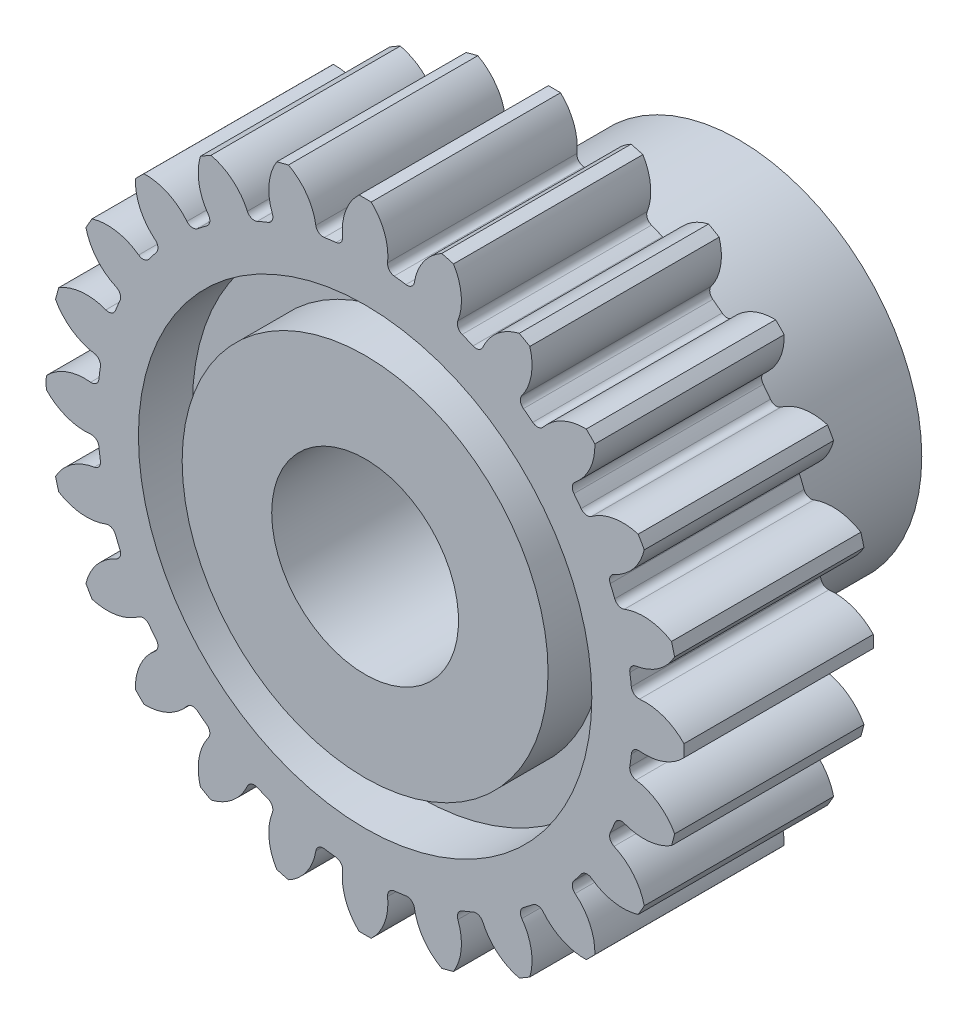
from build123d import *

# Parameters (mm, degrees)
CUT_EXTRUDE1_DEPTH = 30.856616888
CIRPATTERN1_COUNT  = 24


with BuildPart() as part:
    # Sketch3 → Revolve1 (revolve)
    with BuildSketch(Plane(origin=(0, 0, 0), x_dir=(0, 0, -1), z_dir=(1, 0, 0)), mode=Mode.PRIVATE) as revolve1_sk:
        Polygon((-9.525, 16.256), (0.127, 16.256), (0.127, 11.557), (-2.630714286, 11.557), (-2.630714286, 9.32688), (9.525, 9.32688), (9.525, 4.7625), (-9.525, 4.7625), (-9.525, 9.32688), (-6.767285714, 9.32688), (-6.767285714, 11.557), (-9.525, 11.557), align=None)
    revolve(revolve1_sk.sketch.rotate(Axis((0, 0, -9.525), (0, 0, 1)), 90), axis=Axis((0, 0, -9.525), (0, 0, 1)))

    # Sketch4 → Cut-Extrude1 (cut, symmetric)
    with BuildSketch(Plane.XY.offset(9.525)):
        with BuildLine():
            ThreePointArc((-0.311033322, 16.253024158), (-0.993075864, 15.21927594), (-1.146582013, 13.990352317))
            ThreePointArc((-1.146582013, 13.990352317), (-1.228821857, 13.711265456), (-1.484059766, 13.571599864))
            ThreePointArc((-1.484059766, 13.571599864), (-1.782008839, 13.53570097), (-2.079096861, 13.493261744))
            ThreePointArc((-2.079096861, 13.493261744), (-2.361785865, 13.562107915), (-2.513456449, 13.810399884))
            ThreePointArc((-2.513456449, 13.810399884), (-2.979800841, 14.957718635), (-3.906157074, 15.779717137))
            ThreePointArc((-3.906157074, 15.779717137), (-2.121833781, 16.116927666), (-0.311033322, 16.253024158))
        make_face()
    cut_extrude1 = extrude(amount=CUT_EXTRUDE1_DEPTH, both=True, mode=Mode.SUBTRACT)

    # CirPattern1: Cut-Extrude1 ×24 about axis
    cirpattern1_axis = Axis((0, 0, 0), (0, 0, 1))
    for i in range(1, CIRPATTERN1_COUNT):
        add(cut_extrude1.rotate(cirpattern1_axis, i * 360 / CIRPATTERN1_COUNT), mode=Mode.SUBTRACT)


solid = part.part
